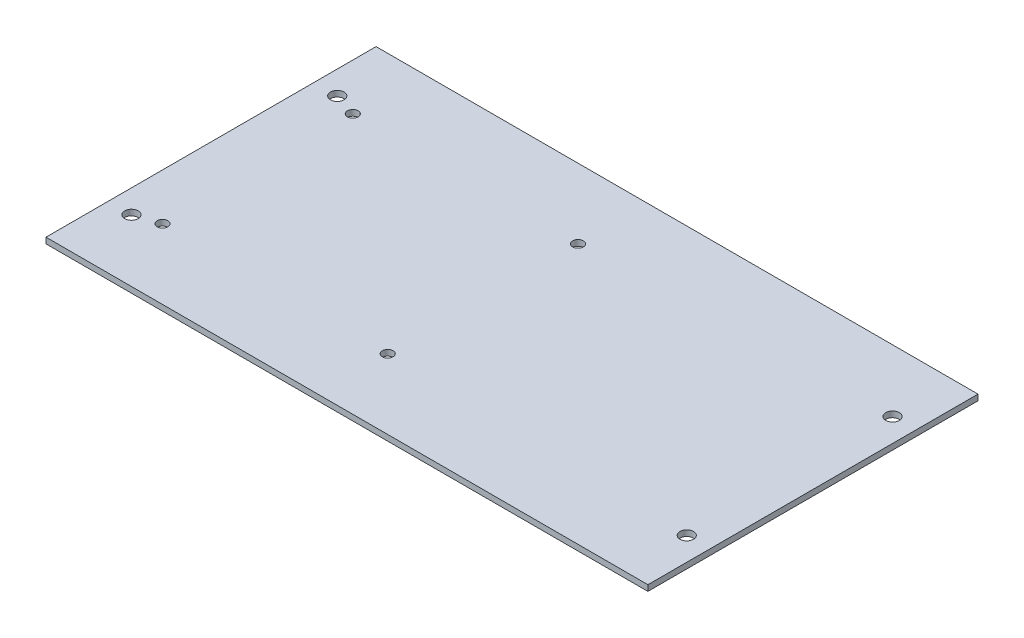
from build123d import *

# Parameters (mm, degrees)
SKETCH_1_W          = 155
SKETCH_1_H          = 85
EXTRUDE_1_DEPTH     = 1.5
SKETCH_2_R          = 1.75
CUT_EXTRUDE_1_DEPTH = 89.401074654
SKETCH_3_R          = 1.375
CUT_EXTRUDE_2_DEPTH = 10


with BuildPart() as part:
    # Эскиз1 → Бобышка-Вытянуть1 (new body)
    with BuildSketch(Plane(origin=(0, 0, 0), x_dir=(1, 0, 0), z_dir=(0, 1, 0))):
        Rectangle(SKETCH_1_W, SKETCH_1_H)
    extrude(amount=EXTRUDE_1_DEPTH)

    # Эскиз2 → Вырез-Вытянуть1 (cut, through all)
    with BuildSketch(Plane(origin=(0, 1.5, 0), x_dir=(1, 0, 0), z_dir=(0, 1, 0))):
        with Locations(Location((-71.5, 26.5, 0), (0, 0, 270))):
            Circle(SKETCH_2_R)
        with Locations(Location((-71.5, -26.5, 0), (0, 0, 270))):
            Circle(SKETCH_2_R)
        with Locations(Location((71.5, -26.5, 0), (0, 0, 270))):
            Circle(SKETCH_2_R)
        with Locations(Location((71.5, 26.5, 0), (0, 0, 270))):
            Circle(SKETCH_2_R)
    extrude(amount=-CUT_EXTRUDE_1_DEPTH, mode=Mode.SUBTRACT)

    # Эскиз3 → Вырез-Вытянуть2 (cut)
    with BuildSketch(Plane(origin=(0, 1.5, 0), x_dir=(1, 0, 0), z_dir=(0, 1, 0))):
        with Locations(Location((-65.5, 24.5, 0), (0, 0, 270))):
            Circle(SKETCH_3_R)
        with Locations(Location((-65.5, -24.5, 0), (0, 0, 270))):
            Circle(SKETCH_3_R)
        with Locations(Location((-7.5, 24.5, 0), (0, 0, 270))):
            Circle(SKETCH_3_R)
        with Locations(Location((-7.5, -24.5, 0), (0, 0, 270))):
            Circle(SKETCH_3_R)
    extrude(amount=-CUT_EXTRUDE_2_DEPTH, mode=Mode.SUBTRACT)


solid = part.part
